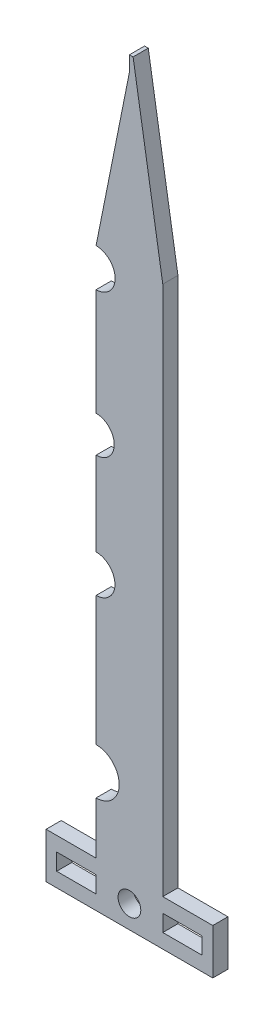
from build123d import *

# Parameters (mm, degrees)
SKETCH_1_R      = 1.5
SKETCH_1_W      = 5.2
SKETCH_1_H      = 2.2
EXTRUDE_1_DEPTH = 2


with BuildPart() as part:
    # 草图1 → 凸台-拉伸1 (new body)
    with BuildSketch(Plane.XY):
        with BuildLine():
            Line((-11, 0), (-11, -3))
            Line((-11, -3), (11, -3))
            Line((11, -3), (11, 0))
            Line((11, 0), (11, 3))
            Line((11, 3), (4.4, 3))
            Line((4.4, 3), (4.4, 73))
            Line((4.4, 73), (0.486767159, 97.013019707))
            Line((0.486767159, 97.013019707), (0, 97.013019707))
            Line((0, 97.013019707), (0, 95.013019707))
            Line((0, 95.013019707), (-4.4, 73))
            ThreePointArc((-4.4, 73), (-1.88316536, 70.48316536), (-4.4, 67.966330721))
            Line((-4.4, 67.966330721), (-4.4, 53.848593982))
            ThreePointArc((-4.4, 53.848593982), (-2.002653764, 51.451247746), (-4.4, 49.053901511))
            Line((-4.4, 49.053901511), (-4.4, 38))
            ThreePointArc((-4.4, 38), (-1.912982257, 35.512982257), (-4.4, 33.025964514))
            Line((-4.4, 33.025964514), (-4.4, 15.982889536))
            ThreePointArc((-4.4, 15.982889536), (-1.348558079, 12.931447615), (-4.4, 9.880005694))
            Line((-4.4, 9.880005694), (-4.4, 3))
            Line((-4.4, 3), (-11, 3))
            Line((-11, 3), (-11, 0))
        make_face()
        Circle(SKETCH_1_R, mode=Mode.SUBTRACT)
        with Locations((7, 0)):
            Rectangle(SKETCH_1_W, SKETCH_1_H, mode=Mode.SUBTRACT)
        with Locations((-7, 0)):
            Rectangle(SKETCH_1_W, SKETCH_1_H, mode=Mode.SUBTRACT)
    extrude(amount=EXTRUDE_1_DEPTH)


solid = part.part
